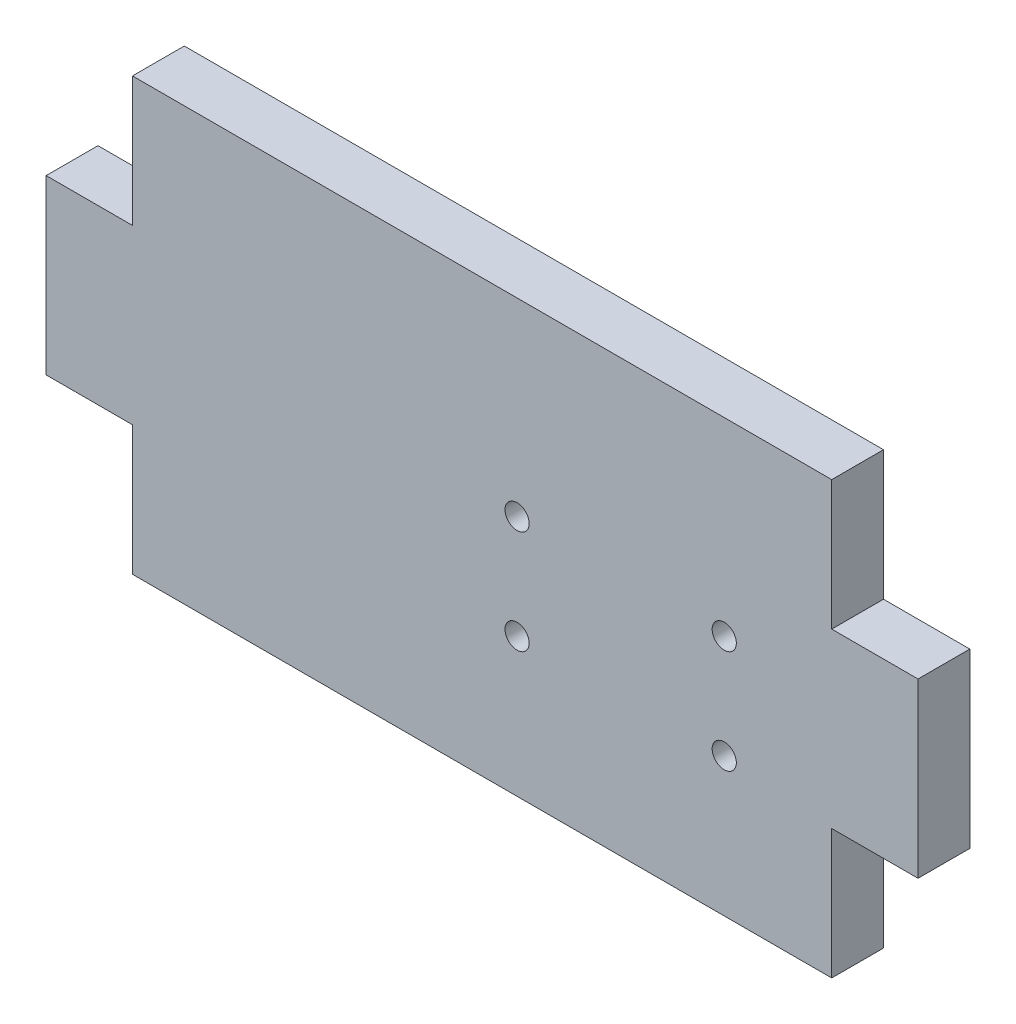
from build123d import *

# Parameters (mm, degrees)
ESQUISSE1_W             = 10
ESQUISSE1_H             = 20
ESQUISSE1_W_2           = 81
ESQUISSE1_H_2           = 50
BOSS_EXTRU_1_DEPTH      = 6
ESQUISSE2_R             = 1.4
ENL_V_MAT_EXTRU_1_DEPTH = 6
ESQUISSE3_R             = 3
ENL_V_MAT_EXTRU_2_DEPTH = 4


with BuildPart() as part:
    # Esquisse1 → Boss.-Extru.1 (new body)
    with BuildSketch(Plane.XY):
        with Locations((-5, 25)):
            Rectangle(ESQUISSE1_W, ESQUISSE1_H)
        with Locations((40.5, 25)):
            Rectangle(ESQUISSE1_W_2, ESQUISSE1_H_2)
        with Locations((86, 25)):
            Rectangle(ESQUISSE1_W, ESQUISSE1_H)
    extrude(amount=BOSS_EXTRU_1_DEPTH)

    # Esquisse2 → Enlèv. mat.-Extru.1 (cut)
    with BuildSketch(Plane(origin=(0, 0, 0), x_dir=(-1, 0, 0), z_dir=(0, 0, -1))):
        with Locations((-44.550340057, 16.065313345)):
            Circle(ESQUISSE2_R)
        with Locations((-44.550340057, 28.065313345)):
            Circle(ESQUISSE2_R)
        with Locations((-68.550340057, 28.065313345)):
            Circle(ESQUISSE2_R)
        with Locations((-68.550340057, 16.065313345)):
            Circle(ESQUISSE2_R)
    extrude(amount=-ENL_V_MAT_EXTRU_1_DEPTH, mode=Mode.SUBTRACT)

    # Esquisse3 → Enlèv. mat.-Extru.2 (cut)
    with BuildSketch(Plane(origin=(0, 0, 0), x_dir=(-1, 0, 0), z_dir=(0, 0, -1))):
        with Locations((-68.550340057, 28.065313345)):
            Circle(ESQUISSE3_R)
        with Locations((-44.550340057, 28.065313345)):
            Circle(ESQUISSE3_R)
        with Locations((-44.550340057, 16.065313345)):
            Circle(ESQUISSE3_R)
        with Locations((-68.550340057, 16.065313345)):
            Circle(ESQUISSE3_R)
    extrude(amount=-ENL_V_MAT_EXTRU_2_DEPTH, mode=Mode.SUBTRACT)


solid = part.part
